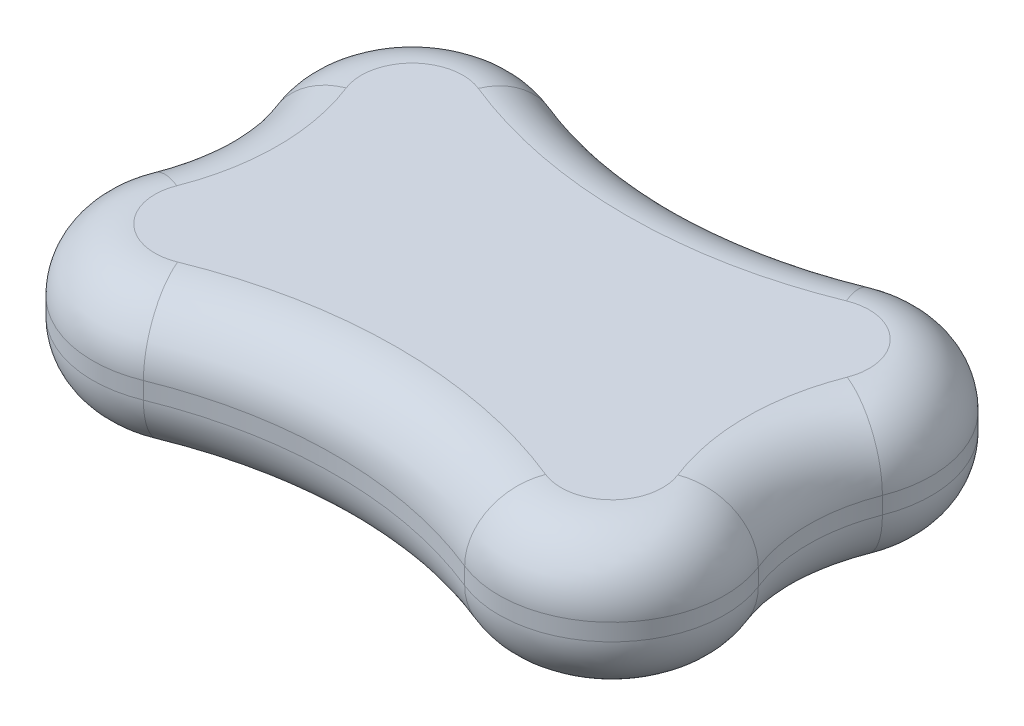
from build123d import *

# Parameters (mm, degrees)
BOSS_EXTRUDE1_DEPTH = 50
FILLET1_R           = 22


with BuildPart() as part:
    # Sketch1 → Boss-Extrude1 (new body)
    with BuildSketch(Plane(origin=(0, 0, 0), x_dir=(1, 0, 0), z_dir=(0, 1, 0))):
        with BuildLine():
            ThreePointArc((-56.848272026, 73.599801144), (-28.960885768, 65.300905733), (0, 62.5))
            ThreePointArc((0, 62.5), (28.960885768, 65.300905733), (56.848272026, 73.599801144))
            ThreePointArc((56.848272026, 73.599801144), (100, 65), (109.144044644, 21.960313031))
            ThreePointArc((109.144044644, 21.960313031), (106.045073596, 11.173947987), (105, 0))
            ThreePointArc((105, 0), (106.045073596, -11.173947987), (109.144044644, -21.960313031))
            ThreePointArc((109.144044644, -21.960313031), (100, -65), (56.848272026, -73.599801144))
            ThreePointArc((56.848272026, -73.599801144), (28.960885768, -65.300905733), (0, -62.5))
            ThreePointArc((0, -62.5), (-28.960885768, -65.300905733), (-56.848272026, -73.599801144))
            ThreePointArc((-56.848272026, -73.599801144), (-100, -65), (-109.144044644, -21.960313031))
            ThreePointArc((-109.144044644, -21.960313031), (-106.045073596, -11.173947987), (-105, 0))
            ThreePointArc((-105, 0), (-106.045073596, 11.173947987), (-109.144044644, 21.960313031))
            ThreePointArc((-109.144044644, 21.960313031), (-100, 65), (-56.848272026, 73.599801144))
        make_face()
    extrude(amount=BOSS_EXTRUDE1_DEPTH)

    # Fillet1
    fillet1_edges = [part.edges().sort_by_distance(p)[0] for p in [
        (0, 0, 62.5),
        (-100, 0, 65),
        (105, 50, 0),
        (-105, 0, 0),
        (-100, 0, -65),
        (0, 0, -62.5),
        (100, 0, -65),
        (105, 0, 0),
        (100, 0, 65),
        (100, 50, -65),
        (0, 50, -62.5),
        (-100, 50, -65),
        (-105, 50, 0),
        (-100, 50, 65),
        (0, 50, 62.5),
        (100, 50, 65),
    ]]
    fillet(fillet1_edges, radius=FILLET1_R)


solid = part.part
